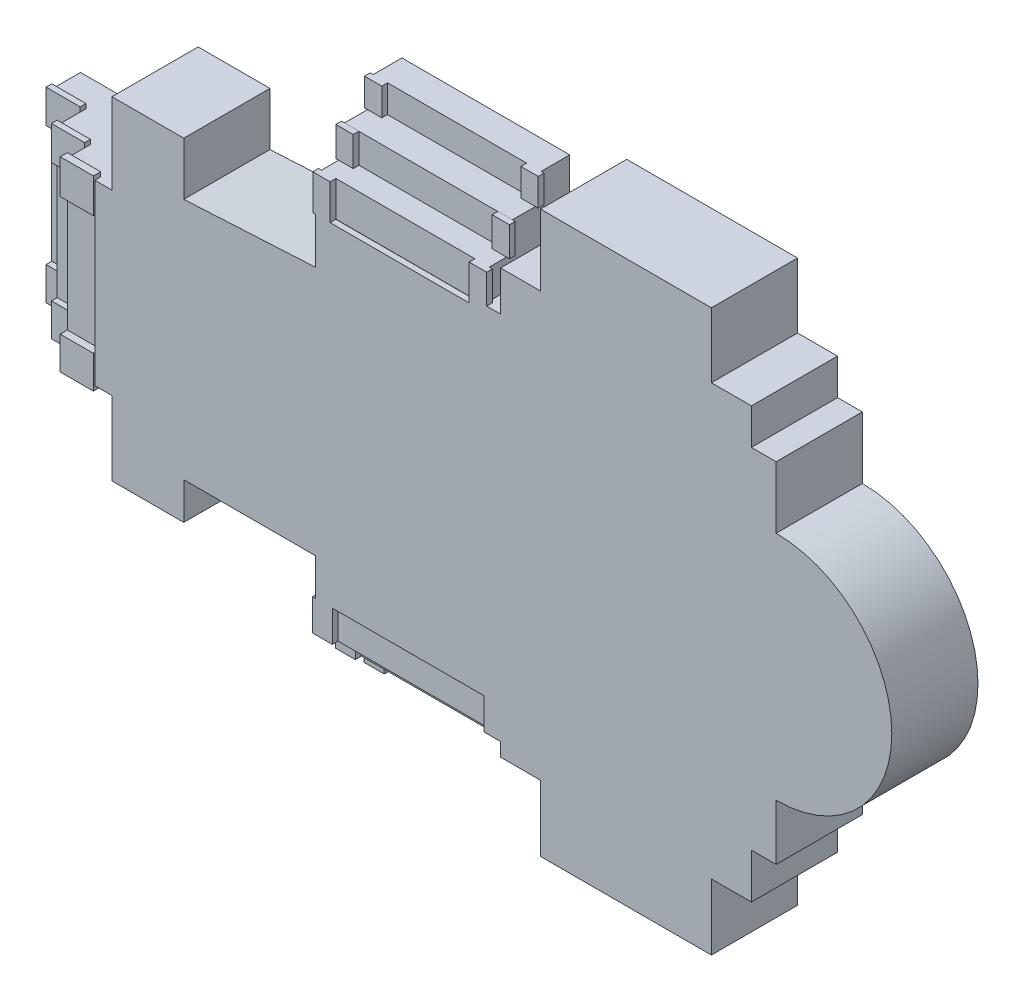
from build123d import *

# Parameters (mm, degrees)
BOSS_EXTRUDE1_DEPTH  = 30
SKETCH4_W            = 35
SKETCH4_H            = 61.907073604
BOSS_EXTRUDE2_DEPTH  = 10
SKETCH5_W            = 23.104058428
SKETCH5_H            = 61.907073604
BOSS_EXTRUDE3_DEPTH  = 10
SKETCH6_W            = 11.552029214
SKETCH6_H            = 61.907073604
BOSS_EXTRUDE5_DEPTH  = 8
SKETCH8_W            = 11.895941572
SKETCH8_H            = 11.490805908
SKETCH8_H_2          = 11.569660377
BOSS_EXTRUDE6_DEPTH  = 2
SKETCH9_W            = 11.552029214
SKETCH9_H            = 11.763067294
SKETCH9_H_2          = 11.444663326
BOSS_EXTRUDE7_DEPTH  = 2
SKETCH10_W           = 11.552029214
SKETCH10_H           = 12.016051613
SKETCH10_H_2         = 11.413040286
BOSS_EXTRUDE8_DEPTH  = 2.5
SKETCH11_W           = 64.341621443
SKETCH11_H           = 28.817099519
BOSS_EXTRUDE9_DEPTH  = 10
SKETCH12_W           = 64.341621443
SKETCH12_H           = 19.413143898
BOSS_EXTRUDE10_DEPTH = 10
SKETCH13_W           = 64.341621443
SKETCH13_H           = 10.936081157
BOSS_EXTRUDE11_DEPTH = 8
SKETCH14_W           = 7
SKETCH14_H           = 9.302294552
BOSS_EXTRUDE12_DEPTH = 2
SKETCH15_W           = 6.954726323
SKETCH15_H           = 8.57872381
SKETCH15_W_2         = 6.927384131
BOSS_EXTRUDE13_DEPTH = 2
SKETCH16_W           = 6.926390046
SKETCH16_H           = 10.936081157
SKETCH16_W_2         = 6.728901939
BOSS_EXTRUDE14_DEPTH = 2
SKETCH17_W           = 58.417259869
SKETCH17_H           = 32.138328606
BOSS_EXTRUDE15_DEPTH = 10
SKETCH18_W           = 58.429148121
SKETCH18_H           = 22.541723998
BOSS_EXTRUDE16_DEPTH = 10
SKETCH19_W           = 58.429148121
SKETCH19_H           = 12.314239644
BOSS_EXTRUDE17_DEPTH = 8
SKETCH20_W           = 30
SKETCH20_H           = 115.814918598
BOSS_EXTRUDE18_DEPTH = 25
SKETCH21_W           = 6.015404917
SKETCH21_H           = 9.543718354
SKETCH21_W_2         = 6.015404916
BOSS_EXTRUDE19_DEPTH = 2
SKETCH22_W           = 6.058740194
SKETCH22_H           = 10.280370608
SKETCH22_W_2         = 6.028288377
BOSS_EXTRUDE20_DEPTH = 2
SKETCH23_W           = 6.002521456
SKETCH23_H           = 12.314239644
SKETCH23_W_2         = 6.105589141
BOSS_EXTRUDE21_DEPTH = 2
CUT_EXTRUDE2_DEPTH   = 28


with BuildPart() as part:
    # Sketch1 → Boss-Extrude1 (new body)
    with BuildSketch(Plane.XY):
        with BuildLine():
            Line((-237.128848942, 435.351344416), (-237.128848942, 421.091849934))
            Line((-237.128848942, 421.091849934), (-206.17531214, 421.091849934))
            Line((-206.17531214, 421.091849934), (-206.17531214, 408.223525645))
            Line((-206.17531214, 408.223525645), (-160.266695759, 408.223525645))
            Line((-160.266695759, 408.223525645), (-160.266695759, 395.355201356))
            Line((-160.266695759, 395.355201356), (-131.052121698, 395.355201356))
            Line((-131.052121698, 395.355201356), (-101.837547638, 395.355201356))
            Line((-101.837547638, 395.355201356), (-95.925074316, 395.355201356))
            Line((-95.925074316, 395.355201356), (-95.925074316, 379.704536681))
            Line((-95.925074316, 379.704536681), (-82.013372382, 379.704536681))
            Line((-82.013372382, 379.704536681), (-82.013372382, 356.75022849))
            Line((-82.013372382, 356.75022849), (-22.540846616, 356.75022849))
            Line((-22.540846616, 356.75022849), (-22.540846616, 379.704536681))
            Line((-22.540846616, 379.704536681), (-8.629144682, 379.704536681))
            Line((-8.629144682, 379.704536681), (-8.629144682, 395.355201356))
            Line((-8.629144682, 395.355201356), (0, 395.355201356))
            Line((0, 395.355201356), (0, 414.657687789))
            ThreePointArc((0, 414.657687789), (40.25698747, 454.91467526), (0, 495.17166273))
            Line((0, 495.17166273), (0, 516.734800727))
            Line((0, 516.734800727), (-8.629144682, 516.734800727))
            Line((-8.629144682, 516.734800727), (-8.629144682, 529.255332468))
            Line((-8.629144682, 529.255332468), (-22.540846616, 529.255332468))
            Line((-22.540846616, 529.255332468), (-22.540846616, 551.86184811))
            Line((-22.540846616, 551.86184811), (-82.013372382, 551.86184811))
            Line((-82.013372382, 551.86184811), (-82.013372382, 527.168577178))
            Line((-82.013372382, 527.168577178), (-95.925074316, 527.168577178))
            Line((-95.925074316, 527.168577178), (-95.925074316, 513.256875244))
            Line((-95.925074316, 513.256875244), (-101.837547638, 513.256875244))
            Line((-101.837547638, 513.256875244), (-101.837547638, 511.170119954))
            Line((-101.837547638, 511.170119954), (-131.052121698, 511.170119954))
            Line((-131.052121698, 511.170119954), (-160.266695759, 511.170119954))
            Line((-160.266695759, 511.170119954), (-160.266695759, 495.17166273))
            Line((-160.266695759, 495.17166273), (-206.17531214, 492.737114892))
            Line((-206.17531214, 492.737114892), (-206.17531214, 482.998923538))
            Line((-206.17531214, 482.998923538), (-237.128848942, 482.998923538))
            Line((-237.128848942, 482.998923538), (-237.128848942, 464.565918476))
            Line((-237.128848942, 464.565918476), (-237.128848942, 454.132142026))
            Line((-237.128848942, 454.132142026), (-237.128848942, 435.351344416))
        make_face()
    extrude(amount=BOSS_EXTRUDE1_DEPTH)

    # Sketch4 → Boss-Extrude2 (add)
    with BuildSketch(Plane(origin=(0, 0, 0), x_dir=(-1, 0, 0), z_dir=(0, 0, -1))):
        with Locations((254.628848942, 452.045386736)):
            Rectangle(SKETCH4_W, SKETCH4_H)
    extrude(amount=-BOSS_EXTRUDE2_DEPTH)

    # Sketch5 → Boss-Extrude3 (add)
    with BuildSketch(Plane.XY.offset(10)):
        with Locations((-248.680878156, 452.045386736)):
            Rectangle(SKETCH5_W, SKETCH5_H)
    extrude(amount=BOSS_EXTRUDE3_DEPTH)

    # Sketch6 → Boss-Extrude5 (add)
    with BuildSketch(Plane.XY.offset(20)):
        with Locations((-242.904863549, 452.045386736)):
            Rectangle(SKETCH6_W, SKETCH6_H)
    extrude(amount=BOSS_EXTRUDE5_DEPTH)

    # Sketch8 → Boss-Extrude6 (add)
    with BuildSketch(Plane.XY.offset(10)):
        with Locations((-266.180878156, 425.34644698)):
            Rectangle(SKETCH8_W, SKETCH8_H)
        with Locations((-266.180878156, 478.783753727)):
            Rectangle(SKETCH8_W, SKETCH8_H_2)
    extrude(amount=BOSS_EXTRUDE6_DEPTH)

    # Sketch9 → Boss-Extrude7 (add)
    with BuildSketch(Plane.XY.offset(20)):
        with Locations((-254.456892763, 478.687050268)):
            Rectangle(SKETCH9_W, SKETCH9_H)
        with Locations((-254.456892763, 425.369518271)):
            Rectangle(SKETCH9_W, SKETCH9_H_2)
    extrude(amount=BOSS_EXTRUDE7_DEPTH)

    # Sketch10 → Boss-Extrude8 (add)
    with BuildSketch(Plane.XY.offset(28)):
        with Locations((-242.904863549, 478.560558109)):
            Rectangle(SKETCH10_W, SKETCH10_H)
        with Locations((-242.904863549, 425.385329791)):
            Rectangle(SKETCH10_W, SKETCH10_H_2)
    extrude(amount=BOSS_EXTRUDE8_DEPTH)

    # Sketch11 → Boss-Extrude9 (add)
    with BuildSketch(Plane(origin=(0, 0, 0), x_dir=(-1, 0, 0), z_dir=(0, 0, -1))):
        with Locations((128.095885038, 380.946651597)):
            Rectangle(SKETCH11_W, SKETCH11_H)
    extrude(amount=-BOSS_EXTRUDE9_DEPTH)

    # Sketch12 → Boss-Extrude10 (add)
    with BuildSketch(Plane.XY.offset(10)):
        with Locations((-128.095885038, 385.648629407)):
            Rectangle(SKETCH12_W, SKETCH12_H)
    extrude(amount=BOSS_EXTRUDE10_DEPTH)

    # Sketch13 → Boss-Extrude11 (add)
    with BuildSketch(Plane.XY.offset(20)):
        with Locations((-128.095885038, 389.887160778)):
            Rectangle(SKETCH13_W, SKETCH13_H)
    extrude(amount=BOSS_EXTRUDE11_DEPTH)

    # Sketch14 → Boss-Extrude12 (add)
    with BuildSketch(Plane.XY.offset(10)):
        with Locations((-157.909862062, 371.189249113)):
            Rectangle(SKETCH14_W, SKETCH14_H)
        with Locations((-98.195021783, 371.189249113)):
            Rectangle(SKETCH14_W, SKETCH14_H)
    extrude(amount=BOSS_EXTRUDE12_DEPTH)

    # Sketch15 → Boss-Extrude13 (add)
    with BuildSketch(Plane.XY.offset(20)):
        with Locations((-157.932498901, 380.129758294)):
            Rectangle(SKETCH15_W, SKETCH15_H)
        with Locations((-98.158713849, 380.129758294)):
            Rectangle(SKETCH15_W_2, SKETCH15_H)
    extrude(amount=BOSS_EXTRUDE13_DEPTH)

    # Sketch16 → Boss-Extrude14 (add)
    with BuildSketch(Plane.XY.offset(28)):
        with Locations((-157.946667039, 389.887160778)):
            Rectangle(SKETCH16_W, SKETCH16_H)
        with Locations((-98.257954944, 389.887160778)):
            Rectangle(SKETCH16_W_2, SKETCH16_H)
    extrude(amount=BOSS_EXTRUDE14_DEPTH)

    # Sketch17 → Boss-Extrude15 (add)
    with BuildSketch(Plane(origin=(0, 0, 0), x_dir=(-1, 0, 0), z_dir=(0, 0, -1))):
        with Locations((131.046177572, 527.239284257)):
            Rectangle(SKETCH17_W, SKETCH17_H)
    extrude(amount=-BOSS_EXTRUDE15_DEPTH)

    # Sketch18 → Boss-Extrude16 (add)
    with BuildSketch(Plane.XY.offset(10)):
        with Locations((-131.052121699, 522.440981953)):
            Rectangle(SKETCH18_W, SKETCH18_H)
    extrude(amount=BOSS_EXTRUDE16_DEPTH)

    # Sketch19 → Boss-Extrude17 (add)
    with BuildSketch(Plane.XY.offset(20)):
        with Locations((-131.052121699, 517.327239776)):
            Rectangle(SKETCH19_W, SKETCH19_H)
    extrude(amount=BOSS_EXTRUDE17_DEPTH)

    # Sketch20 → Boss-Extrude18 (add)
    with BuildSketch(Plane.ZY.offset(206.17531214)):
        with Locations((15, 453.262660655)):
            Rectangle(SKETCH20_W, SKETCH20_H)
    extrude(amount=BOSS_EXTRUDE18_DEPTH)

    # Sketch21 → Boss-Extrude19 (add)
    with BuildSketch(Plane.XY.offset(10)):
        with Locations((-158.254585418, 538.536589383)):
            Rectangle(SKETCH21_W, SKETCH21_H)
        with Locations((-103.834847481, 538.536589383)):
            Rectangle(SKETCH21_W_2, SKETCH21_H)
    extrude(amount=BOSS_EXTRUDE19_DEPTH)

    # Sketch22 → Boss-Extrude20 (add)
    with BuildSketch(Plane.XY.offset(20)):
        with Locations((-158.232917779, 528.624544902)):
            Rectangle(SKETCH22_W, SKETCH22_H)
        with Locations((-103.828405751, 528.624544902)):
            Rectangle(SKETCH22_W_2, SKETCH22_H)
    extrude(amount=BOSS_EXTRUDE20_DEPTH)

    # Sketch23 → Boss-Extrude21 (add)
    with BuildSketch(Plane.XY.offset(28)):
        with Locations((-158.261027148, 517.327239776)):
            Rectangle(SKETCH23_W, SKETCH23_H)
        with Locations((-103.789755369, 517.327239776)):
            Rectangle(SKETCH23_W_2, SKETCH23_H)
    extrude(amount=BOSS_EXTRUDE21_DEPTH)

    # Sketch24 → Cut-Extrude2 (cut)
    with BuildSketch(Plane(origin=(0, 0, 0), x_dir=(-1, 0, 0), z_dir=(0, 0, -1))):
        with BuildLine():
            Line((228.979940095, 479.759783132), (228.979940095, 506.732020696))
            Line((228.979940095, 506.732020696), (209.499990744, 506.732020696))
            Line((209.499990744, 506.732020696), (209.499990744, 490.248986629))
            Line((209.499990744, 490.248986629), (156.454590203, 490.248986629))
            Line((156.454590203, 490.248986629), (156.454590203, 511.227393623))
            Line((156.454590203, 511.227393623), (107.005488005, 511.227393623))
            Line((107.005488005, 511.227393623), (92.919986166, 511.227393623))
            Line((92.919986166, 511.227393623), (92.919986166, 524.863358168))
            Line((92.919986166, 524.863358168), (77.935409742, 524.863358168))
            Line((77.935409742, 524.863358168), (77.935409742, 546.890685512))
            Line((77.935409742, 546.890685512), (26.088775316, 546.890685512))
            Line((26.088775316, 546.890685512), (26.088775316, 527.710427689))
            Line((26.088775316, 527.710427689), (13.202039591, 527.710427689))
            Line((13.202039591, 527.710427689), (13.202039591, 514.374154672))
            Line((13.202039591, 514.374154672), (4.510985265, 514.374154672))
            Line((4.510985265, 514.374154672), (4.510985265, 493.245901914))
            ThreePointArc((4.510985265, 493.245901914), (-34.748604966, 456.383843911), (2.113453037, 417.124253681))
            Line((2.113453037, 417.124253681), (2.113453037, 396.745229744))
            Line((2.113453037, 396.745229744), (10.804507363, 396.745229744))
            Line((10.804507363, 396.745229744), (10.804507363, 381.161270263))
            Line((10.804507363, 381.161270263), (26.088775316, 381.161270263))
            Line((26.088775316, 381.161270263), (26.088775316, 358.684405627))
            Line((26.088775316, 358.684405627), (80.632633499, 358.684405627))
            Line((80.632633499, 358.684405627), (80.632633499, 381.161270263))
            Line((80.632633499, 381.161270263), (80.632633499, 390.751399175))
            Line((80.632633499, 390.751399175), (80.632633499, 399.4424535))
            Line((80.632633499, 399.4424535), (156.454590203, 399.4424535))
            Line((156.454590203, 399.4424535), (156.454590203, 410.531040054))
            Line((156.454590203, 410.531040054), (209.499990744, 410.531040054))
            Line((209.499990744, 410.531040054), (209.499990744, 399.4424535))
            Line((209.499990744, 399.4424535), (228.979940095, 399.4424535))
            Line((228.979940095, 399.4424535), (228.979940095, 424.017158836))
            Line((228.979940095, 424.017158836), (228.979940095, 479.759783132))
        make_face()
    extrude(amount=-CUT_EXTRUDE2_DEPTH, mode=Mode.SUBTRACT)


solid = part.part
